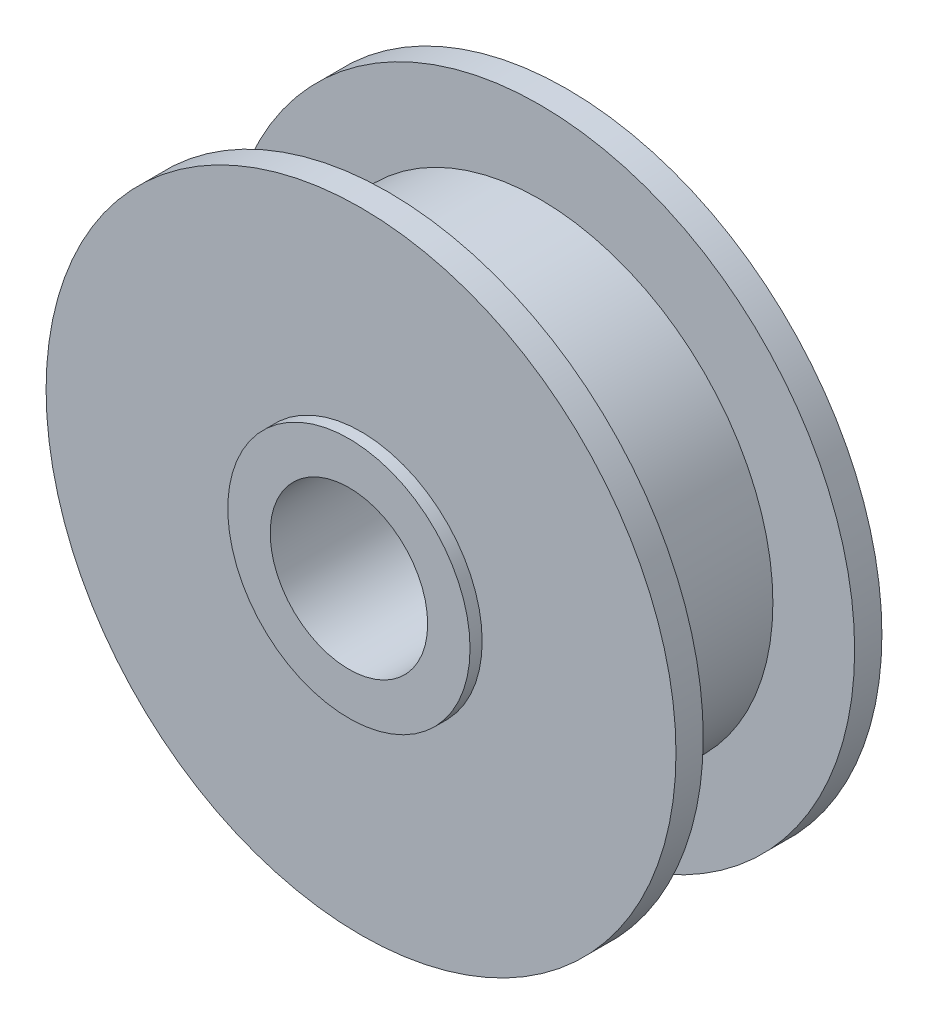
from build123d import *


with BuildPart() as part:
    # Sketch1 → Revolve1 (revolve)
    with BuildSketch(Plane(origin=(0, 0, 0), x_dir=(0, 0, -1), z_dir=(1, 0, 0)), mode=Mode.PRIVATE) as revolve1_sk:
        Polygon((-1.9, 1.3), (-1.9, 2), (-1.7, 2), (-1.7, 5.2), (-1.25, 5.2), (-1.25, 3.85), (1.25, 3.85), (1.25, 5.2), (1.7, 5.2), (1.7, 2), (1.9, 2), (1.9, 1.3), align=None)
    revolve(revolve1_sk.sketch.rotate(Axis((0, 0, 1.9), (0, 0, -1)), 90), axis=Axis((0, 0, 1.9), (0, 0, -1)))


solid = part.part
